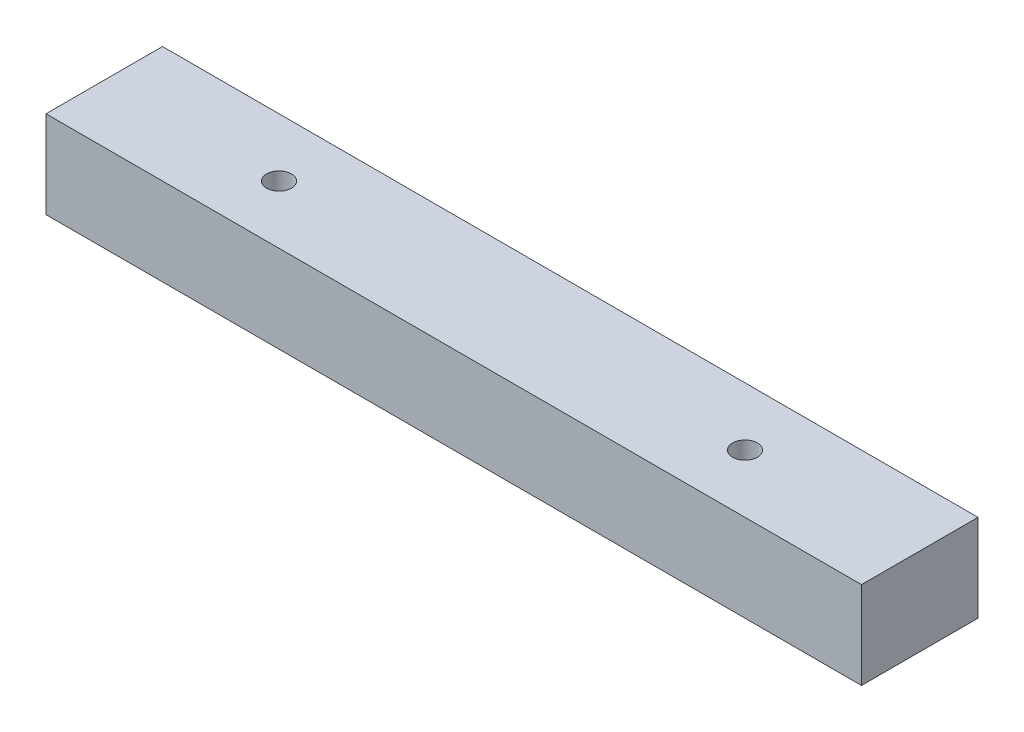
from build123d import *

# Parameters (mm, degrees)
SKETCH1_W             = 88.9
SKETCH1_H             = 12.7
BOSS_EXTRUDE1_DEPTH   = 9.525
F_6_32_TAPPED_HOLE1_D = 2.7051


with BuildPart() as part:
    # Sketch1 → Boss-Extrude1 (new body)
    with BuildSketch(Plane(origin=(0, 0, 0), x_dir=(1, 0, 0), z_dir=(0, 1, 0))):
        Rectangle(SKETCH1_W, SKETCH1_H)
    extrude(amount=BOSS_EXTRUDE1_DEPTH)

    # #6-32 Tapped Hole1 (through all)
    with Locations(Plane.XZ):
        with Locations((25.4, 0), (-25.4, 0)):
            Hole(F_6_32_TAPPED_HOLE1_D / 2)


solid = part.part
